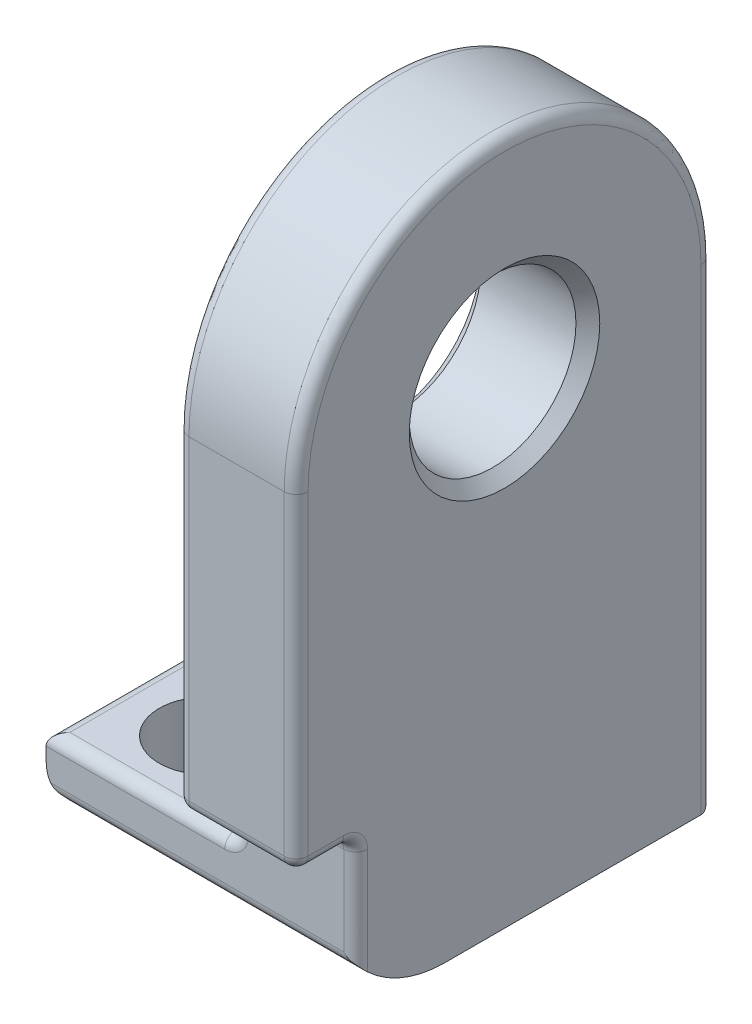
from build123d import *

# Parameters (mm, degrees)
SKETCH_1_R          = 1.4
EXTRUDE_1_DEPTH     = 2
SKETCH_2_W          = 5.2
SKETCH_2_H          = 7
SKETCH_2_R          = 0.8
EXTRUDE_2_DEPTH     = 1.5
SKETCH_5_W          = 6
SKETCH_5_H          = 1
CUT_EXTRUDE_1_DEPTH = 2.5
CUT_EXTRUDE_2_REACH = 12.163
FILLET_1_R          = 0.2
FILLET_2_R          = 0.2
CHAMFER_1_SIZE      = 0.2


with BuildPart() as part:
    # 草图1 → 凸台-拉伸1 (new body)
    with BuildSketch(Plane(origin=(0, 0, 0), x_dir=(0, 0, -1), z_dir=(1, 0, 0))):
        with BuildLine():
            Line((3.5, 0), (3.5, -8))
            Line((3.5, -8), (-3.5, -8))
            Line((-3.5, -8), (-3.5, 0))
            ThreePointArc((-3.5, 0), (0, 3.5), (3.5, 0))
        make_face()
        Circle(SKETCH_1_R, mode=Mode.SUBTRACT)
    extrude(amount=EXTRUDE_1_DEPTH)

    # 草图2 → 凸台-拉伸2 (add)
    with BuildSketch(Plane.XZ.offset(8)):
        with Locations((-0.6, 0)):
            Rectangle(SKETCH_2_W, SKETCH_2_H)
        with Locations(Location((-1.8, 1.2, 0), (0, 0, 270))):
            Circle(SKETCH_2_R, mode=Mode.SUBTRACT)
        with Locations(Location((-1.8, -2.3, 0), (0, 0, 270))):
            Circle(SKETCH_2_R, mode=Mode.SUBTRACT)
    extrude(amount=-EXTRUDE_2_DEPTH)

    # 草图5 → 切除-拉伸1 (cut)
    with BuildSketch(Plane.XZ.offset(8)):
        with Locations((-1, 3)):
            Rectangle(SKETCH_5_W, SKETCH_5_H)
    extrude(amount=-CUT_EXTRUDE_1_DEPTH, mode=Mode.SUBTRACT)

    # 草图6 → 切除-拉伸2 (cut, up to next)
    with BuildSketch(Plane.ZY.offset(3.2), mode=Mode.PRIVATE) as cut_extrude_2_sk1:
        with BuildLine():
            Line((1, -8), (1, -8.325127743))
            Line((1, -8.325127743), (3.27705392, -8.325127743))
            Line((3.27705392, -8.325127743), (3.27705392, -6))
            Line((3.27705392, -6), (2.897366596, -6))
            ThreePointArc((2.897366596, -6), (2.378404875, -7.407669683), (1, -8))
        make_face()
    cut_extrude_2_tool1 = extrude(cut_extrude_2_sk1.sketch, amount=-CUT_EXTRUDE_2_REACH, mode=Mode.PRIVATE) & part.part
    add(cut_extrude_2_tool1.solids().sort_by_distance((-3.2, -7.575754, 2.569334))[0], mode=Mode.SUBTRACT)

    # 圆角1
    fillet_1_edges = [part.edges().sort_by_distance(p)[0] for p in [
        (0, -6.5, -0.5),
    ]]
    fillet(fillet_1_edges, radius=FILLET_1_R)

    # 圆角2
    fillet_2_edges = [part.edges().sort_by_distance(p)[0] for p in [
        (2, 3.5, 0),
        (2, -2.75, 3.5),
        (-1.7, -6.5, -3.5),
        (-3.2, -6.5, -0.5),
        (0, -2.75, 3.5),
        (1, -5.5, 3.5),
        (-1.7, -6.5, 2.5),
        (1, -5.5, 2.5),
        (2, -6.383095189, 2.5),
        (0, 3.5, 0),
        (2, -5.5, 3),
        (0, -5.5, 3),
        (-3.2, -8, -1.25),
        (-0.6, -7.266190379, 2.5),
        (-3.2, -7.806716397, 1.834936608),
        (2, -4, -3.5),
        (0, -5.9, 2.5),
        (0, -3.15, -3.5),
        (-0.6, -8, -3.5),
        (-0.058578644, -6.441421356, -3.5),
        (-0.058578644, -6.441421356, 2.5),
    ]]
    fillet(fillet_2_edges, radius=FILLET_2_R)

    # 倒角1
    chamfer_1_edges = [part.edges().sort_by_distance(p)[0] for p in [
        (0, 0, 1.4),
        (2, 0, 1.4),
    ]]
    chamfer(chamfer_1_edges, length=CHAMFER_1_SIZE)


solid = part.part
